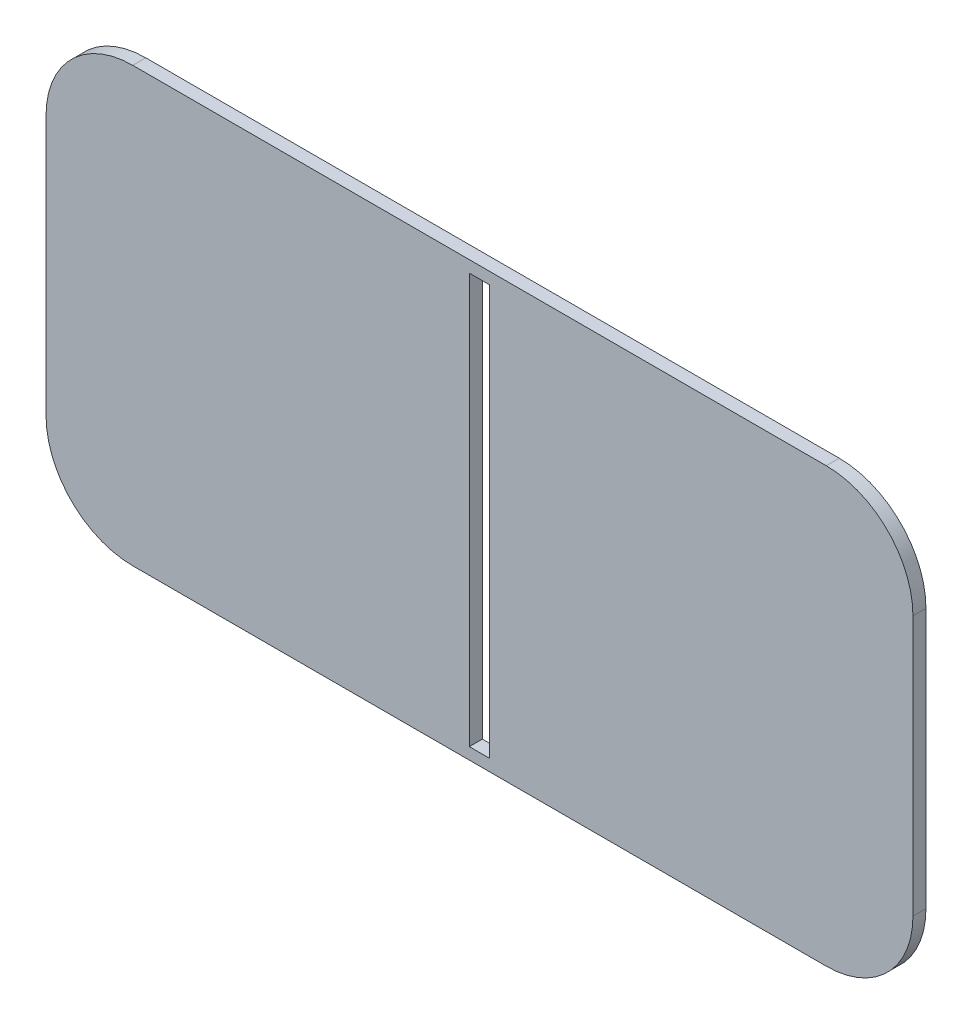
from build123d import *

# Parameters (mm, degrees)
SKETCH2_W           = 4.698137425
SKETCH2_H           = 94.603403599
BOSS_EXTRUDE2_DEPTH = 3


with BuildPart() as part:
    # Sketch2 → Boss-Extrude2 (new body)
    with BuildSketch(Plane.XY):
        with BuildLine():
            Line((16.234639487, 2.019768487), (176.234639487, 2.019768487))
            ThreePointArc((176.234639487, 2.019768487), (190.376775111, -3.838095889), (196.234639487, -17.980231513))
            Line((196.234639487, -17.980231513), (196.234639487, -77.980231513))
            ThreePointArc((196.234639487, -77.980231513), (190.376775111, -92.122367137), (176.234639487, -97.980231513))
            Line((176.234639487, -97.980231513), (16.234639487, -97.980231513))
            ThreePointArc((16.234639487, -97.980231513), (2.092503864, -92.122367137), (-3.765360513, -77.980231513))
            Line((-3.765360513, -77.980231513), (-3.765360513, -17.980231513))
            ThreePointArc((-3.765360513, -17.980231513), (2.092503864, -3.838095889), (16.234639487, 2.019768487))
        make_face()
        with Locations((96.234639488, -47.980231514)):
            Rectangle(SKETCH2_W, SKETCH2_H, mode=Mode.SUBTRACT)
    extrude(amount=BOSS_EXTRUDE2_DEPTH)


solid = part.part
